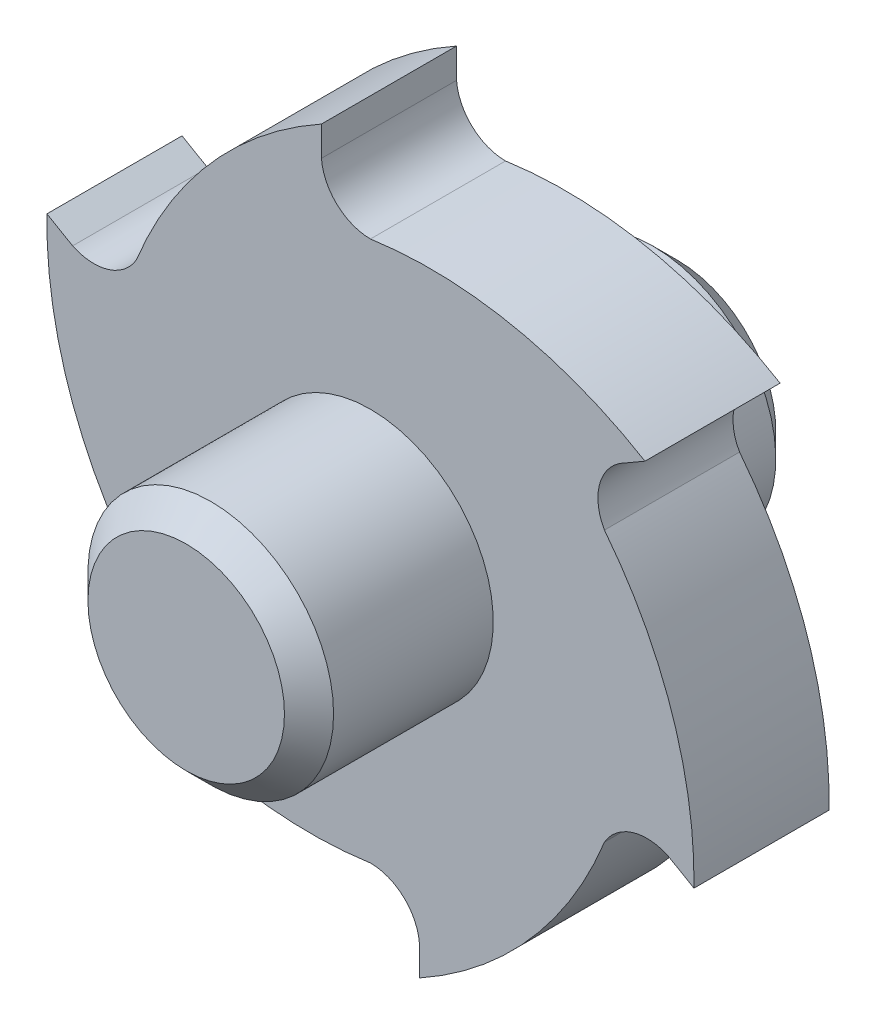
from build123d import *

# Parameters (mm, degrees)
SKETCH_4_R               = 13.5
EXTRUDE_1_DEPTH          = 1
CHAMFER_1_SIZE           = 2
CUT_EXTRUDE_1_DEPTH      = 65.031242374
PATTERN_CIRCULAR_1_COUNT = 6


with BuildPart() as part:
    # 草圖3 → 旋轉1 (revolve)
    with BuildSketch(Plane(origin=(0, 0, 0), x_dir=(0, 0, -1), z_dir=(1, 0, 0))):
        Polygon((0, 0), (15, 0), (15, 20), (26, 20), (26, 0), (40, 0), (40, -10), (0, -10), align=None)
    revolve(axis=Axis((0, -10, -40), (0, 0, 1)))

    # 草圖4 → 填料-伸長1 (add)
    with BuildSketch(Plane(origin=(0, 0, -26), x_dir=(-1, 0, 0), z_dir=(0, 0, -1))):
        with Locations(Location((0, -10, 0), (0, 0, 90))):
            Circle(SKETCH_4_R)
    extrude(amount=EXTRUDE_1_DEPTH)

    # 導角1
    chamfer_1_edges = [part.edges().sort_by_distance(p)[0] for p in [
        (0, -20, -40),
        (0, -20, 0),
    ]]
    chamfer(chamfer_1_edges, length=CHAMFER_1_SIZE)

    # 草圖1 → 除料-伸長1 (cut, through all)
    with BuildSketch(Plane.XY):
        with BuildLine():
            Line((-3.988148122, 15.692307692), (-3.988148122, 19.733729577))
            ThreePointArc((-3.988148122, 19.733729577), (13.235915698, 16.922305541), (25.980762114, 5))
            ThreePointArc((25.980762114, 5), (13.7123081, 11.179459253), (0, 12))
            ThreePointArc((0, 12), (-2.717464882, 13.064802457), (-3.988148122, 15.692307692))
        make_face()
    cut_extrude_1 = extrude(amount=-CUT_EXTRUDE_1_DEPTH, mode=Mode.SUBTRACT)

    # 環狀複製排列1: 除料-伸長1 ×6 about axis
    pattern_circular_1_axis = Axis((0, -10, 0), (0, 0, 1))
    for i in range(1, PATTERN_CIRCULAR_1_COUNT):
        add(cut_extrude_1.rotate(pattern_circular_1_axis, i * 360 / PATTERN_CIRCULAR_1_COUNT), mode=Mode.SUBTRACT)


solid = part.part
